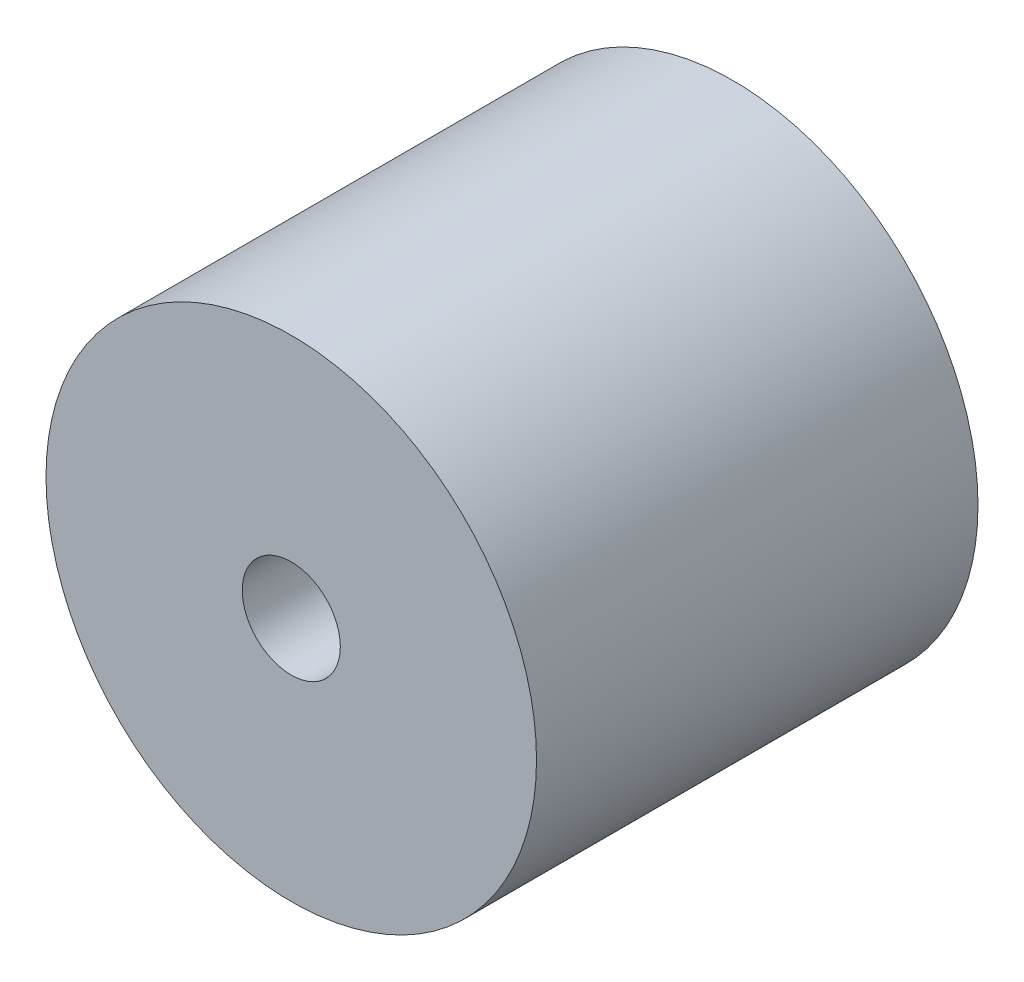
from build123d import *

# Parameters (mm, degrees)
SKETCH1_R           = 15
SKETCH1_R_2         = 3
BOSS_EXTRUDE1_DEPTH = 27


with BuildPart() as part:
    # Sketch1 → Boss-Extrude1 (new body)
    with BuildSketch(Plane.XY):
        Circle(SKETCH1_R)
        Circle(SKETCH1_R_2, mode=Mode.SUBTRACT)
    extrude(amount=BOSS_EXTRUDE1_DEPTH)


solid = part.part
